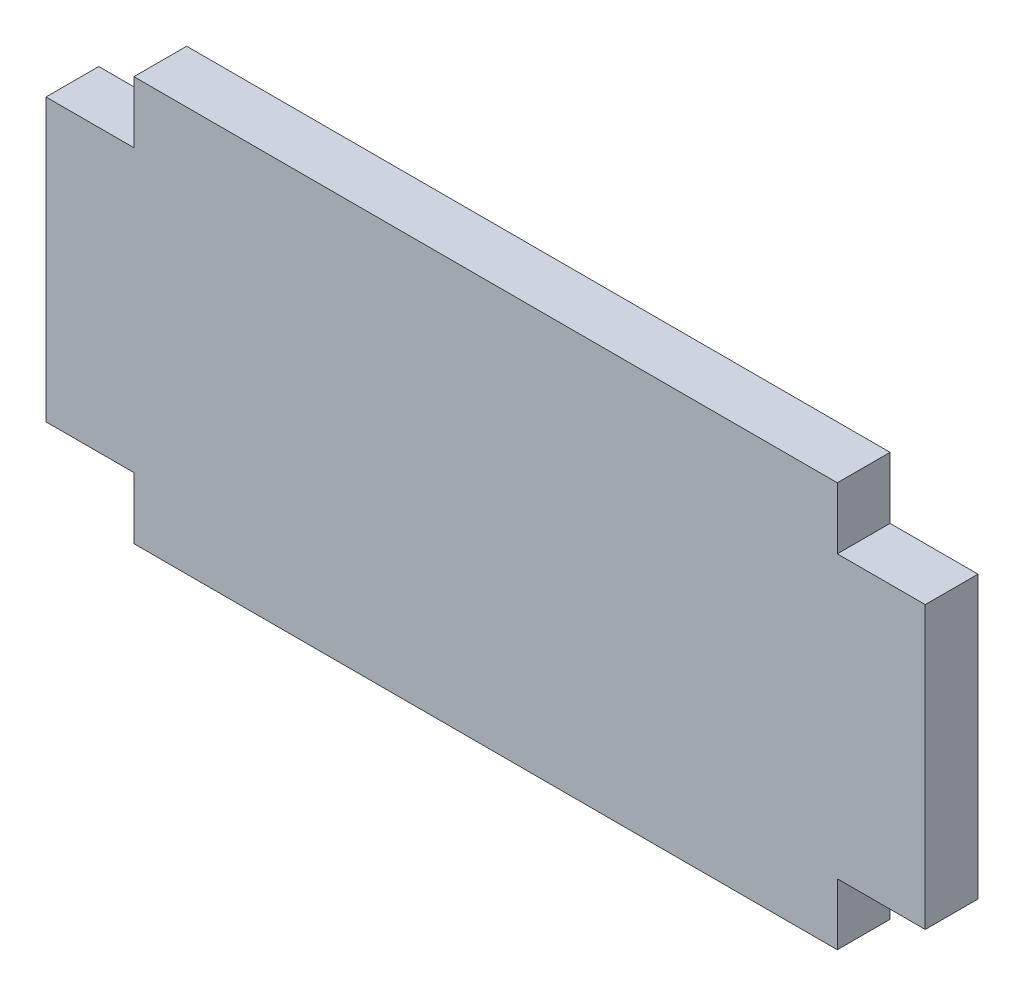
from build123d import *

# Parameters (mm, degrees)
BOSS_EXTRU_1_DEPTH = 6


with BuildPart() as part:
    # Esquisse1 → Boss.-Extru.1 (new body)
    with BuildSketch(Plane.XY):
        Polygon((-4, -16), (-4, 16), (6, 16), (6, 23), (86, 23), (86, 16), (96, 16), (96, -16), (86, -16), (86, -23), (6, -23), (6, -16), align=None)
    extrude(amount=BOSS_EXTRU_1_DEPTH)


solid = part.part
